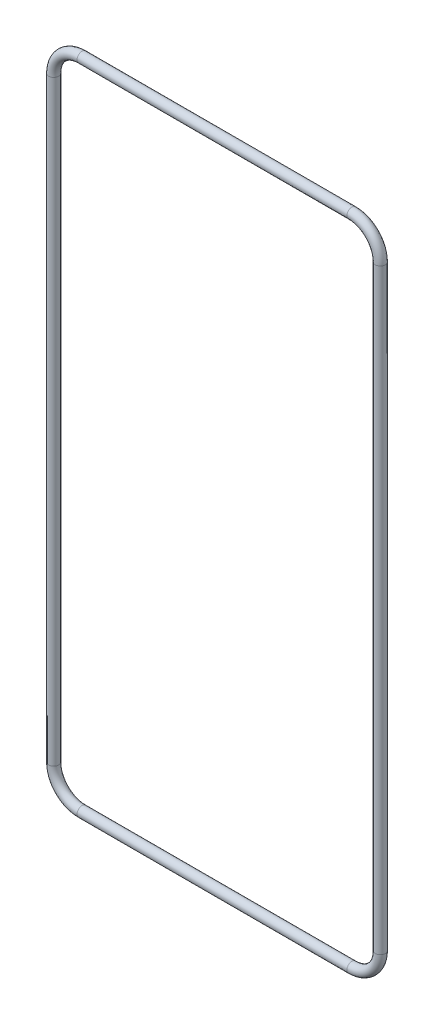
from build123d import *

# Parameters (mm, degrees)
ESBO_O2_R = 1.765


with BuildPart() as part:
    # Varredura1: sweep along a path in Esboço1
    with BuildLine(Plane.XY) as varredura1_path:
        Line((-55.997697015, -123.71845513), (39.002302985, -123.71845513))
        ThreePointArc((39.002302985, -123.71845513), (46.073370797, -120.789522942), (49.002302985, -113.71845513))
        Line((49.002302985, -113.71845513), (49.002302985, 96.28154487))
        ThreePointArc((49.002302985, 96.28154487), (46.073370797, 103.352612682), (39.002302985, 106.28154487))
        Line((39.002302985, 106.28154487), (-55.997697015, 106.28154487))
        ThreePointArc((-55.997697015, 106.28154487), (-63.068764827, 103.352612682), (-65.997697015, 96.28154487))
        Line((-65.997697015, 96.28154487), (-65.997697015, -113.71845513))
        ThreePointArc((-65.997697015, -113.71845513), (-63.068764827, -120.789522942), (-55.997697015, -123.71845513))
    # Esboço2 → Varredura1 (sweep)
    with BuildSketch(Plane(origin=(0, 0, 0), x_dir=(1, 0, 0), z_dir=(0, 1, 0))):
        with Locations((49.002302985, 0)):
            Circle(ESBO_O2_R)
    sweep(path=varredura1_path.line)


solid = part.part
